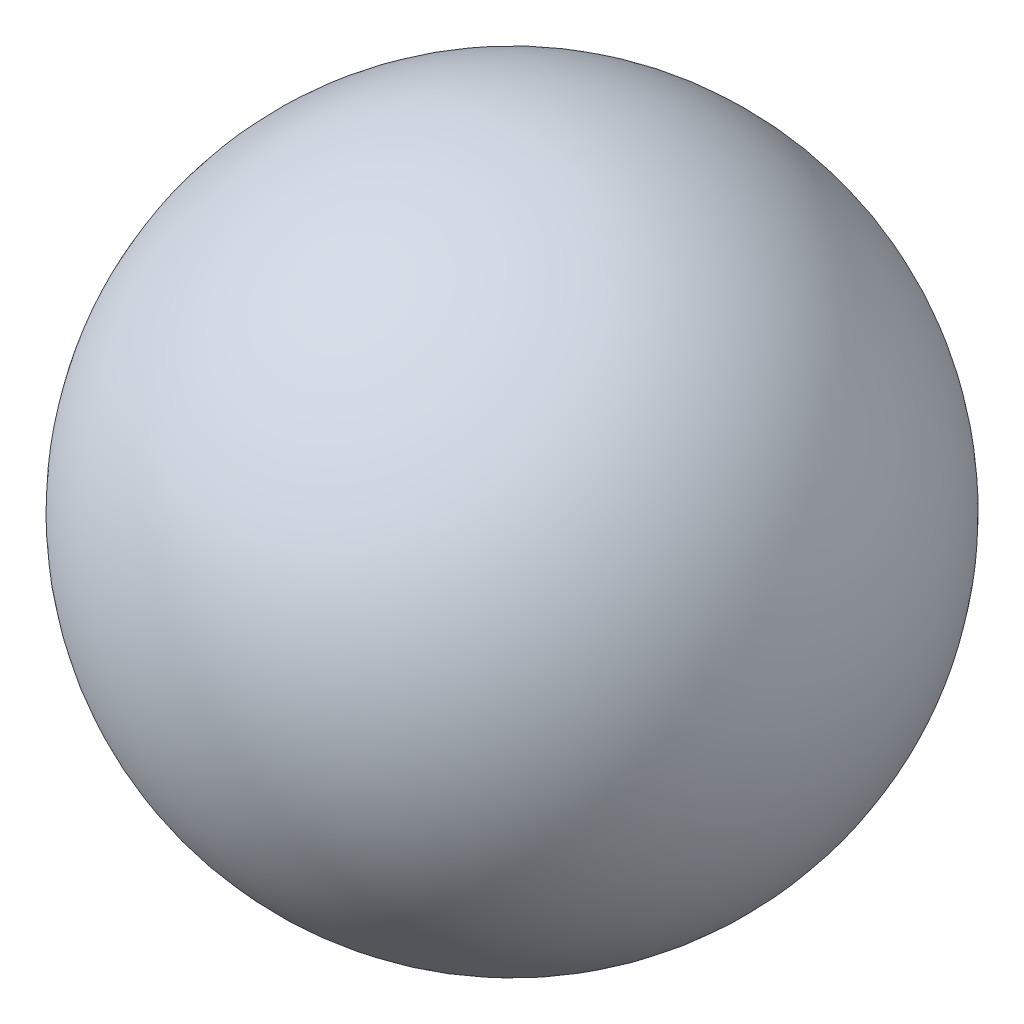
from build123d import *

# Parameters (mm, degrees)
M10X1_5_TAPPED_HOLE1_D     = 8.5
M10X1_5_TAPPED_HOLE1_DEPTH = 13.5
M10X1_5_TAPPED_HOLE1_TIP   = 4.25


with BuildPart() as part:
    # Sketch1 → Revolve1 (revolve)
    with BuildSketch(Plane.XY):
        with BuildLine():
            Line((0, 15), (0, -15))
            ThreePointArc((0, -15), (15, 0), (0, 15))
        make_face()
    revolve(axis=Axis((0, 15, 0), (0, -1, 0)))

    # M10x1.5 Tapped Hole1
    with Locations(Plane(origin=(-14.959538349, -1.101004898, 0.000766878), x_dir=(0.073400326655, -0.997302557927, 0), z_dir=(-0.997302556623, -0.073400326559, 5.11252e-05))):
        with Locations((0, 0)):
            Hole(M10X1_5_TAPPED_HOLE1_D / 2, depth=M10X1_5_TAPPED_HOLE1_DEPTH)
            with Locations((0, 0, -(M10X1_5_TAPPED_HOLE1_DEPTH + M10X1_5_TAPPED_HOLE1_TIP / 2))):  # 90° drill point
                Cone(0, M10X1_5_TAPPED_HOLE1_D / 2, M10X1_5_TAPPED_HOLE1_TIP, mode=Mode.SUBTRACT)


solid = part.part
